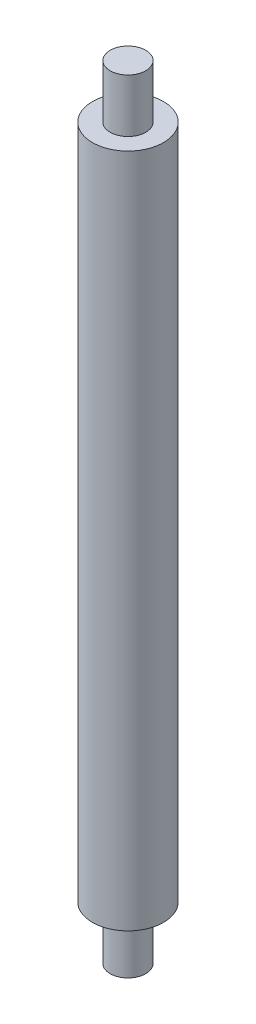
from build123d import *


with BuildPart() as part:
    # Esquisse1 → Révolution1 (revolve)
    with BuildSketch(Plane.XY, mode=Mode.PRIVATE) as r_volution1_sk:
        Polygon((0, 11), (0.5, 11), (0.5, 9.5), (1, 9.5), (1, -9.5), (0.5, -9.5), (0.5, -11), (0, -11), align=None)
    revolve(r_volution1_sk.sketch.rotate(Axis((0, 11, 0), (0, -1, 0)), 180), axis=Axis((0, 11, 0), (0, -1, 0)))


solid = part.part
